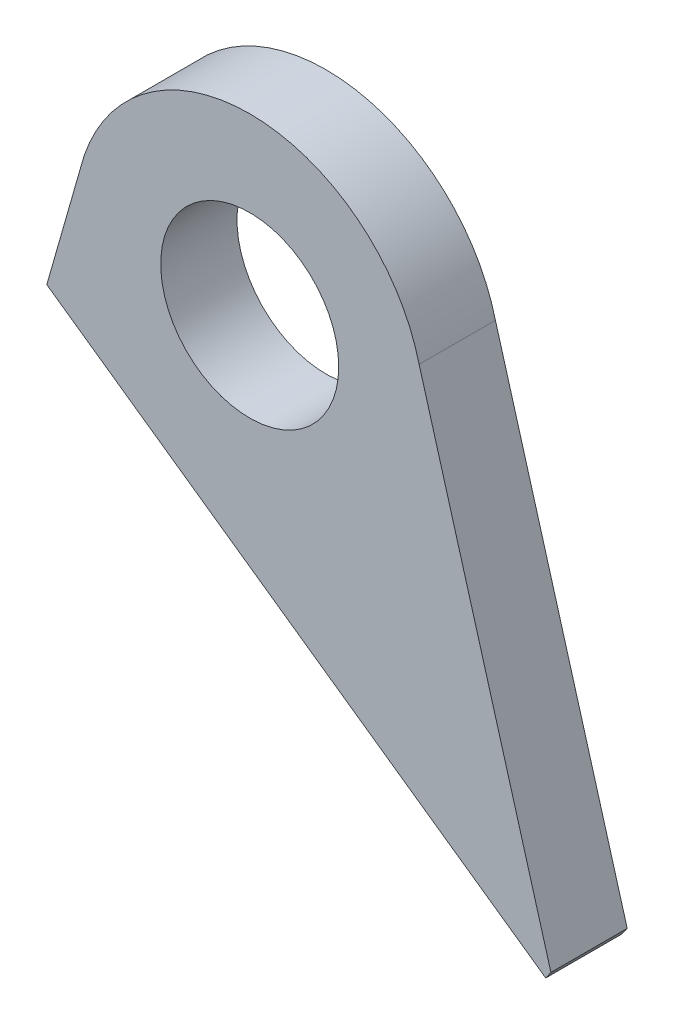
from build123d import *

# Parameters (mm, degrees)
BOSS_EXTRUDE1_DEPTH = 15
SKETCH2_R           = 17.5
CUT_EXTRUDE1_DEPTH  = 87.168439698
CUT_EXTRUDE2_DEPTH  = 15
SKETCH4_W           = 2.2
SKETCH4_H           = 15
CUT_EXTRUDE3_DEPTH  = 10


with BuildPart() as part:
    # Sketch1 → Boss-Extrude1 (new body)
    with BuildSketch(Plane.XY):
        with BuildLine():
            Line((-60, -60), (-33.308172666, 33.308172666))
            ThreePointArc((-33.308172666, 33.308172666), (0, 59.328706637), (33.308172666, 33.308172666))
            Line((33.308172666, 33.308172666), (60, -60))
            Line((60, -60), (-60, -60))
        make_face()
    extrude(amount=BOSS_EXTRUDE1_DEPTH)

    # Sketch2 → Cut-Extrude1 (cut, through all)
    with BuildSketch(Plane.XY.offset(15)):
        with Locations((0, 25)):
            Circle(SKETCH2_R)
    extrude(amount=-CUT_EXTRUDE1_DEPTH, mode=Mode.SUBTRACT)

    # Sketch3 → Cut-Extrude2 (cut)
    with BuildSketch(Plane.XY.offset(15)):
        Polygon((60, -60), (-39.897432064, 10.273715489), (-60, -60), align=None)
    extrude(amount=-CUT_EXTRUDE2_DEPTH, mode=Mode.SUBTRACT)

    # Sketch4 → Cut-Extrude3 (cut)
    with BuildSketch(Plane(origin=(-8.372906684, -11.902485457, 0), x_dir=(0.8179007281921136, -0.5753593649388272, 0), z_dir=(-0.5753593649388272, -0.8179007281921136, 0))):
        with Locations((82.495605588, 7.5)):
            Rectangle(SKETCH4_W, SKETCH4_H)
    extrude(amount=-CUT_EXTRUDE3_DEPTH, mode=Mode.SUBTRACT)


solid = part.part
